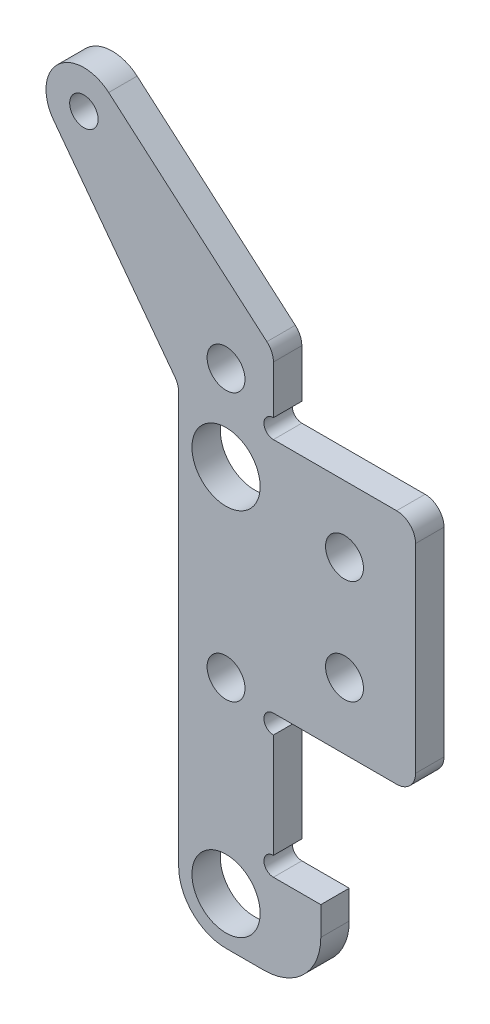
from build123d import *

# Parameters (mm, degrees)
SKETCH_2_R          = 3.6
SKETCH_2_R_2        = 1.5
SKETCH_2_R_3        = 2
EXTRUDE_1_DEPTH     = 3
SKETCH_8_R          = 1
CUT_EXTRUDE_1_DEPTH = 105.27847333
FILLET_1_R          = 2
FILLET_2_R          = 6


with BuildPart() as part:
    # 草图2 → 凸台-拉伸1 (new body)
    with BuildSketch(Plane.XY):
        with BuildLine():
            Line((-65, 0), (-65, 44))
            Line((-65, 44), (-78.2, 61.6))
            ThreePointArc((-78.2, 61.6), (-77.728789328, 66.924672427), (-72.384272007, 67.026213321))
            Line((-72.384272007, 67.026213321), (-55, 52))
            Line((-55, 52), (-55, 44))
            Line((-55, 44), (-40, 44))
            Line((-40, 44), (-40, 19))
            Line((-40, 19), (-55, 19))
            Line((-55, 19), (-55, 4))
            Line((-55, 4), (-50, 4))
            Line((-50, 4), (-50, -5))
            Line((-50, -5), (-60, -5))
            ThreePointArc((-60, -5), (-63.535533906, -3.535533906), (-65, 0))
        make_face()
        with Locations((-60, 39)):
            Circle(SKETCH_2_R, mode=Mode.SUBTRACT)
        with Locations((-60, 0)):
            Circle(SKETCH_2_R, mode=Mode.SUBTRACT)
        with Locations((-75, 64)):
            Circle(SKETCH_2_R_2, mode=Mode.SUBTRACT)
        with Locations((-60, 19.75)):
            Circle(SKETCH_2_R_3, mode=Mode.SUBTRACT)
        with Locations((-60, 48)):
            Circle(SKETCH_2_R_3, mode=Mode.SUBTRACT)
        with Locations((-47.5, 37)):
            Circle(SKETCH_2_R_3, mode=Mode.SUBTRACT)
        with Locations((-47.5, 26)):
            Circle(SKETCH_2_R_3, mode=Mode.SUBTRACT)
    extrude(amount=EXTRUDE_1_DEPTH)

    # 草图8 → 切除-拉伸1 (cut, through all)
    with BuildSketch(Plane.XY.offset(3)):
        with Locations((-55, 45)):
            Circle(SKETCH_8_R)
        with Locations((-55, 18)):
            Circle(SKETCH_8_R)
        with Locations((-55, 5)):
            Circle(SKETCH_8_R)
    extrude(amount=-CUT_EXTRUDE_1_DEPTH, mode=Mode.SUBTRACT)

    # 圆角1
    fillet_1_edges = [part.edges().sort_by_distance(p)[0] for p in [
        (-55, 52, 1.5),
        (-40, 44, 1.5),
        (-40, 19, 1.5),
        (-65, 44, 1.5),
    ]]
    fillet(fillet_1_edges, radius=FILLET_1_R)

    # 圆角2
    fillet_2_edges = [part.edges().sort_by_distance(p)[0] for p in [
        (-50, -5, 1.5),
    ]]
    fillet(fillet_2_edges, radius=FILLET_2_R)


solid = part.part
